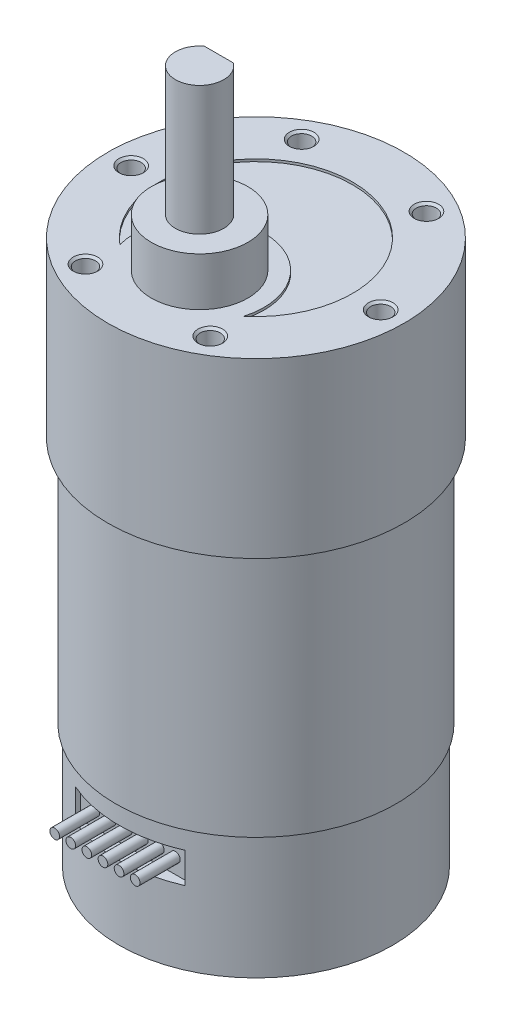
from build123d import *

# Parameters (mm, degrees)
SKETCH_1_R                   = 18.4
EXTRUDE_1_DEPTH              = 21.5
SKETCH_2_R                   = 6
EXTRUDE_2_DEPTH              = 6
SKETCH_3_R                   = 3
EXTRUDE_3_DEPTH              = 16
SKETCH_4_W                   = 5
SKETCH_4_H                   = 1
CUT_EXTRUDE_1_DEPTH          = 11.85
SKETCH_5_R                   = 17.4
EXTRUDE_4_DEPTH              = 30.7
SKETCH_6_R                   = 17
EXTRUDE_5_DEPTH              = 15.4
CUT_EXTRUDE_START            = 15
SKETCH_7_W                   = 13.6
SKETCH_7_H                   = 3.8
CUT_EXTRUDE_2_DEPTH          = 58.435350486
SKETCH_8_R                   = 0.6
EXTRUDE_6_DEPTH              = 5
HOLE_WIZARD_M3_1_D           = 2.5
HOLE_WIZARD_M3_1_DEPTH       = 8.5
HOLE_WIZARD_M3_1_CSINK_D     = 3.05
HOLE_WIZARD_M3_1_CSINK_ANGLE = 90
HOLE_WIZARD_M3_1_TIP         = 0.751075774
CUT_EXTRUDE_3_DEPTH          = 0.3


with BuildPart() as part:
    # 草图1 → 凸台-拉伸1 (new body)
    with BuildSketch(Plane(origin=(0, 0, 0), x_dir=(1, 0, 0), z_dir=(0, 1, 0))):
        with Locations(Location((0, 0, 0), (0, 0, 270))):
            Circle(SKETCH_1_R)
    extrude(amount=-EXTRUDE_1_DEPTH)

    # 草图2 → 凸台-拉伸2 (add)
    with BuildSketch(Plane(origin=(0, 0, 0), x_dir=(1, 0, 0), z_dir=(0, 1, 0))):
        with Locations(Location((0, -7, 0), (0, 0, 270))):
            Circle(SKETCH_2_R)
    extrude(amount=EXTRUDE_2_DEPTH)

    # 草图3 → 凸台-拉伸3 (add)
    with BuildSketch(Plane(origin=(0, 6, 0), x_dir=(1, 0, 0), z_dir=(0, 1, 0))):
        with Locations(Location((0, -7, 0), (0, 0, 270))):
            Circle(SKETCH_3_R)
    extrude(amount=EXTRUDE_3_DEPTH)

    # 草图4 → 切除-拉伸1 (cut)
    with BuildSketch(Plane(origin=(0, 22, 0), x_dir=(1, 0, 0), z_dir=(0, 1, 0))):
        with Locations((0, -4.1)):
            Rectangle(SKETCH_4_W, SKETCH_4_H)
    extrude(amount=-CUT_EXTRUDE_1_DEPTH, mode=Mode.SUBTRACT)

    # 草图5 → 凸台-拉伸4 (add)
    with BuildSketch(Plane.XZ.offset(21.5)):
        with Locations(Location((0, 0, 0), (0, 0, 90))):
            Circle(SKETCH_5_R)
    extrude(amount=EXTRUDE_4_DEPTH)

    # 草图6 → 凸台-拉伸5 (add)
    with BuildSketch(Plane.XZ.offset(52.2)):
        with Locations(Location((0, 0, 0), (0, 0, 90))):
            Circle(SKETCH_6_R)
    extrude(amount=EXTRUDE_5_DEPTH)

    # 草图7 → 切除-拉伸2 (cut, through all)
    with BuildSketch(Plane.XY.offset(CUT_EXTRUDE_START)):
        with Locations((0, -56.6)):
            Rectangle(SKETCH_7_W, SKETCH_7_H)
    extrude(amount=CUT_EXTRUDE_2_DEPTH, mode=Mode.SUBTRACT)

    # 草图8 → 凸台-拉伸6 (add)
    with BuildSketch(Plane.XY.offset(15)):
        with Locations((-5, -56.6)):
            Circle(SKETCH_8_R)
        with Locations((-3, -56.6)):
            Circle(SKETCH_8_R)
        with Locations((-1, -56.6)):
            Circle(SKETCH_8_R)
        with Locations(Location((1, -56.6, 0), (0, 0, 180))):
            Circle(SKETCH_8_R)
        with Locations(Location((3, -56.6, 0), (0, 0, 180))):
            Circle(SKETCH_8_R)
        with Locations(Location((5, -56.6, 0), (0, 0, 180))):
            Circle(SKETCH_8_R)
    extrude(amount=EXTRUDE_6_DEPTH)

    # M3 螺纹孔1
    with Locations(Plane(origin=(0, 0, 0), x_dir=(1, 0, 0), z_dir=(0, 1, 0))):
        with Locations((-7.75, 13.423393759), (15.5, 0), (7.75, -13.423393759), (-7.75, -13.423393759), (-15.5, 0), (7.75, 13.423393759)):
            CounterSinkHole(HOLE_WIZARD_M3_1_D / 2, HOLE_WIZARD_M3_1_CSINK_D / 2, depth=HOLE_WIZARD_M3_1_DEPTH, counter_sink_angle=HOLE_WIZARD_M3_1_CSINK_ANGLE)
            with Locations((0, 0, -(HOLE_WIZARD_M3_1_DEPTH + HOLE_WIZARD_M3_1_TIP / 2))):  # 118° drill point
                Cone(0, HOLE_WIZARD_M3_1_D / 2, HOLE_WIZARD_M3_1_TIP, mode=Mode.SUBTRACT)

    # 草图12 → 切除-拉伸3 (cut)
    with BuildSketch(Plane(origin=(0, 0, 0), x_dir=(1, 0, 0), z_dir=(0, 1, 0))):
        with BuildLine():
            ThreePointArc((7.687453335, -9.214285714), (0, 12), (-7.687453335, -9.214285714))
            ThreePointArc((-7.687453335, -9.214285714), (0, 1), (7.687453335, -9.214285714))
        make_face()
    extrude(amount=-CUT_EXTRUDE_3_DEPTH, mode=Mode.SUBTRACT)


solid = part.part
